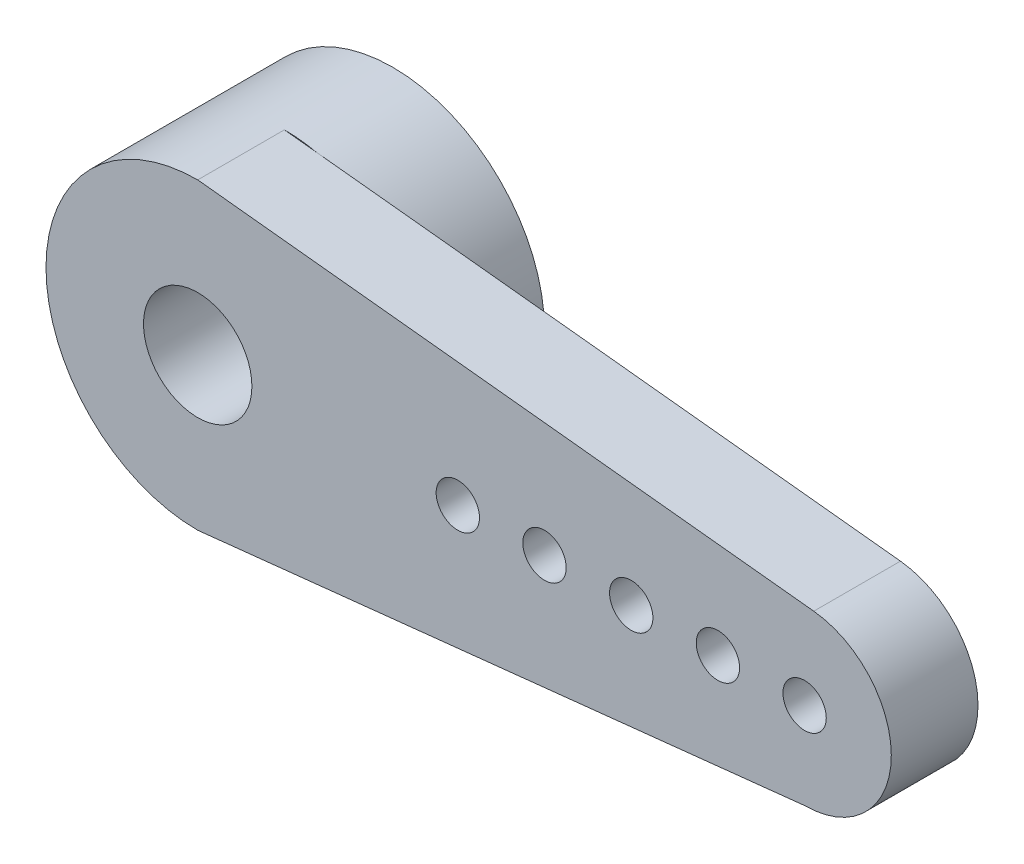
from build123d import *

# Parameters (mm, degrees)
SKETCH_1_R          = 1.25
SKETCH_1_R_2        = 0.5
EXTRUDE_1_DEPTH     = 2
CUT_EXTRUDE_1_REACH = 18.5
SKETCH_2_R          = 0.5
EXTRUDE_START       = 2.5
SKETCH_3_R          = 3.5
SKETCH_3_R_2        = 2.5
EXTRUDE_2_DEPTH     = 2.5


with BuildPart() as part:
    # 草圖1 → 填料-伸長1 (new body)
    with BuildSketch(Plane.XY):
        with BuildLine():
            Line((0, 3.5), (14.211482552, 1.988787352))
            ThreePointArc((14.211482552, 1.988787352), (15.997194871, -0.105889793), (14, -2))
            Line((14, -2), (0, -3.5))
            ThreePointArc((0, -3.5), (-3.5, 0), (0, 3.5))
        make_face()
        Circle(SKETCH_1_R, mode=Mode.SUBTRACT)
        with Locations((14, 0)):
            Circle(SKETCH_1_R_2, mode=Mode.SUBTRACT)
    extrude(amount=EXTRUDE_1_DEPTH)

    # 草圖2 → 除料-伸長1 (cut, up to next)
    with BuildSketch(Plane.XY.offset(2), mode=Mode.PRIVATE) as cut_extrude_1_sk1:
        with Locations((12, 0)):
            Circle(SKETCH_2_R)
    cut_extrude_1_tool1 = extrude(cut_extrude_1_sk1.sketch, amount=-CUT_EXTRUDE_1_REACH, mode=Mode.PRIVATE) & part.part
    # 草圖2 → 除料-伸長1 (cut, up to next)
    with BuildSketch(Plane.XY.offset(2), mode=Mode.PRIVATE) as cut_extrude_1_sk2:
        with Locations((10, 0)):
            Circle(SKETCH_2_R)
    cut_extrude_1_tool2 = extrude(cut_extrude_1_sk2.sketch, amount=-CUT_EXTRUDE_1_REACH, mode=Mode.PRIVATE) & part.part
    # 草圖2 → 除料-伸長1 (cut, up to next)
    with BuildSketch(Plane.XY.offset(2), mode=Mode.PRIVATE) as cut_extrude_1_sk3:
        with Locations((8, 0)):
            Circle(SKETCH_2_R)
    cut_extrude_1_tool3 = extrude(cut_extrude_1_sk3.sketch, amount=-CUT_EXTRUDE_1_REACH, mode=Mode.PRIVATE) & part.part
    # 草圖2 → 除料-伸長1 (cut, up to next)
    with BuildSketch(Plane.XY.offset(2), mode=Mode.PRIVATE) as cut_extrude_1_sk4:
        with Locations((6, 0)):
            Circle(SKETCH_2_R)
    cut_extrude_1_tool4 = extrude(cut_extrude_1_sk4.sketch, amount=-CUT_EXTRUDE_1_REACH, mode=Mode.PRIVATE) & part.part
    add(cut_extrude_1_tool1.solids().sort_by_distance((12, 0, 2))[0], mode=Mode.SUBTRACT)
    add(cut_extrude_1_tool2.solids().sort_by_distance((10, 0, 2))[0], mode=Mode.SUBTRACT)
    add(cut_extrude_1_tool3.solids().sort_by_distance((8, 0, 2))[0], mode=Mode.SUBTRACT)
    add(cut_extrude_1_tool4.solids().sort_by_distance((6, 0, 2))[0], mode=Mode.SUBTRACT)

    # 草圖3 → 填料-伸長2 (add)
    with BuildSketch(Plane(origin=(0, 0, 0), x_dir=(-1, 0, 0), z_dir=(0, 0, -1)).offset(EXTRUDE_START)):
        Circle(SKETCH_3_R)
        Circle(SKETCH_3_R_2, mode=Mode.SUBTRACT)
    extrude(amount=-EXTRUDE_2_DEPTH)


solid = part.part
